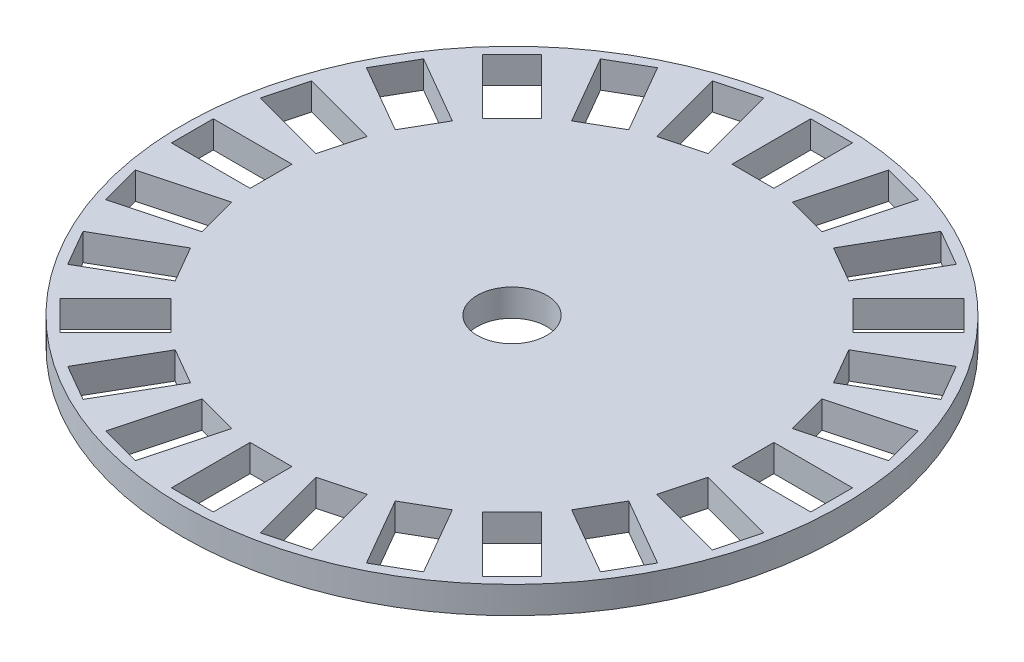
from build123d import *

# Parameters (mm, degrees)
SKETCH1_R           = 36.5
BOSS_EXTRUDE1_DEPTH = 3
SKETCH2_R           = 3.85
CUT_EXTRUDE1_DEPTH  = 52.705899083
SKETCH3_W           = 4.631754054
SKETCH3_H           = 8.712386095
CUT_EXTRUDE2_DEPTH  = 52.705899083
CIRPATTERN1_COUNT   = 24


with BuildPart() as part:
    # Sketch1 → Boss-Extrude1 (new body)
    with BuildSketch(Plane(origin=(0, 0, 0), x_dir=(1, 0, 0), z_dir=(0, 1, 0))):
        with Locations(Location((0, 0, 0), (0, 0, 270))):
            Circle(SKETCH1_R)
    extrude(amount=BOSS_EXTRUDE1_DEPTH)

    # Sketch2 → Cut-Extrude1 (cut, through all)
    with BuildSketch(Plane(origin=(0, 3, 0), x_dir=(1, 0, 0), z_dir=(0, 1, 0))):
        with Locations(Location((0, 0, 0), (0, 0, 270))):
            Circle(SKETCH2_R)
    extrude(amount=-CUT_EXTRUDE1_DEPTH, mode=Mode.SUBTRACT)

    # Sketch3 → Cut-Extrude2 (cut, through all)
    with BuildSketch(Plane(origin=(0, 3, 0), x_dir=(1, 0, 0), z_dir=(0, 1, 0))):
        with Locations((0, 31.044114287)):
            Rectangle(SKETCH3_W, SKETCH3_H)
    cut_extrude2 = extrude(amount=-CUT_EXTRUDE2_DEPTH, mode=Mode.SUBTRACT)

    # CirPattern1: Cut-Extrude2 ×24 about axis
    cirpattern1_axis = Axis((0, 0, 0), (0, 1, 0))
    for i in range(1, CIRPATTERN1_COUNT):
        add(cut_extrude2.rotate(cirpattern1_axis, i * 360 / CIRPATTERN1_COUNT), mode=Mode.SUBTRACT)


solid = part.part
